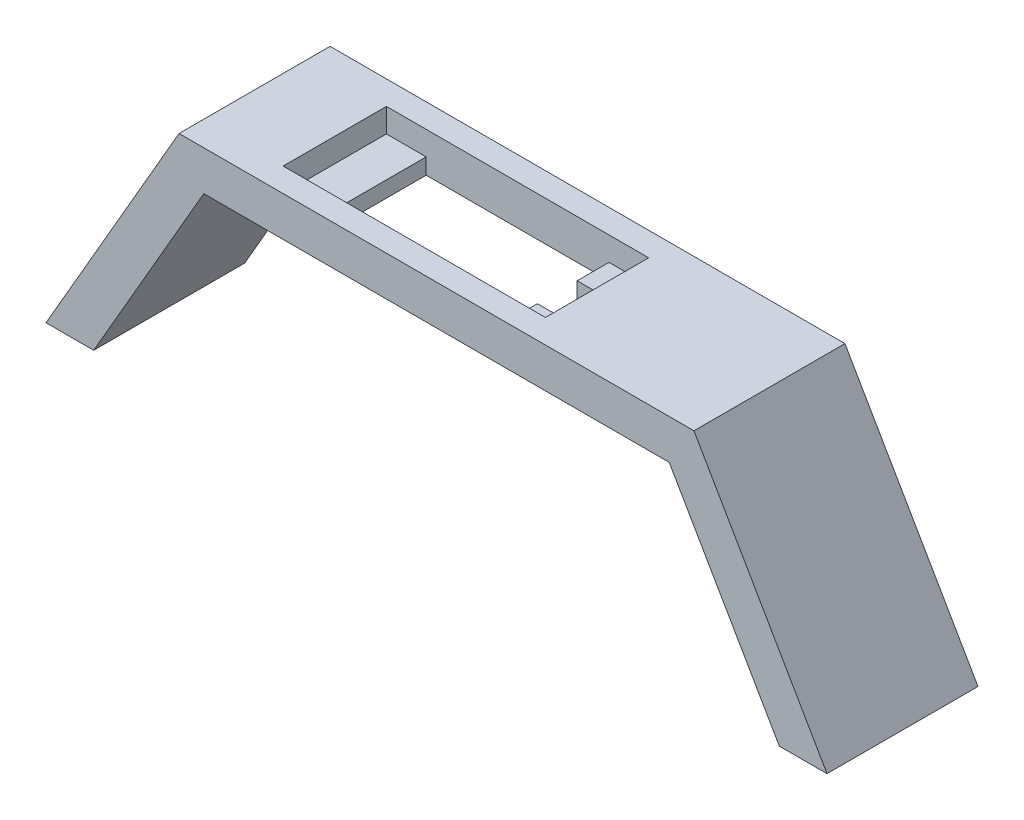
from build123d import *

# Parameters (mm, degrees)
BOSS_EXTRUDE1_DEPTH = 19
SKETCH2_W           = 33
SKETCH2_H           = 13
CUT_EXTRUDE1_DEPTH  = 3
CUT_EXTRUDE2_REACH  = 60.752
SKETCH3_W           = 23
SKETCH3_H           = 13
CUT_EXTRUDE3_REACH  = 60.752
SKETCH4_W           = 5
SKETCH4_H           = 5


with BuildPart() as part:
    # Sketch1 → Boss-Extrude1 (new body)
    with BuildSketch(Plane.XY):
        Polygon((-29.283593539, 0), (29.283593539, 0), (43.14, -24), (49.14, -24), (32.396842194, 5), (-32.396842194, 5), (-49.14, -24), (-43.14, -24), align=None)
    extrude(amount=BOSS_EXTRUDE1_DEPTH)

    # Sketch2 → Cut-Extrude1 (cut)
    with BuildSketch(Plane(origin=(0, 5, 0), x_dir=(1, 0, 0), z_dir=(0, 1, 0))):
        with Locations((-5.8, -9.5)):
            Rectangle(SKETCH2_W, SKETCH2_H)
    extrude(amount=-CUT_EXTRUDE1_DEPTH, mode=Mode.SUBTRACT)

    # Sketch3 → Cut-Extrude2 (cut, up to next)
    with BuildSketch(Plane(origin=(0, 2, 0), x_dir=(1, 0, 0), z_dir=(0, 1, 0)), mode=Mode.PRIVATE) as cut_extrude2_sk1:
        with Locations((-5.8, -9.5)):
            Rectangle(SKETCH3_W, SKETCH3_H)
    cut_extrude2_tool1 = extrude(cut_extrude2_sk1.sketch, amount=-CUT_EXTRUDE2_REACH, mode=Mode.PRIVATE) & part.part
    add(cut_extrude2_tool1.solids().sort_by_distance((-5.8, 2, 9.5))[0], mode=Mode.SUBTRACT)

    # Sketch4 → Cut-Extrude3 (cut, up to next)
    with BuildSketch(Plane(origin=(0, 2, 0), x_dir=(1, 0, 0), z_dir=(0, 1, 0)), mode=Mode.PRIVATE) as cut_extrude3_sk1:
        with Locations((8.2, -9.5)):
            Rectangle(SKETCH4_W, SKETCH4_H)
    cut_extrude3_tool1 = extrude(cut_extrude3_sk1.sketch, amount=-CUT_EXTRUDE3_REACH, mode=Mode.PRIVATE) & part.part
    add(cut_extrude3_tool1.solids().sort_by_distance((8.2, 2, 9.5))[0], mode=Mode.SUBTRACT)


solid = part.part
